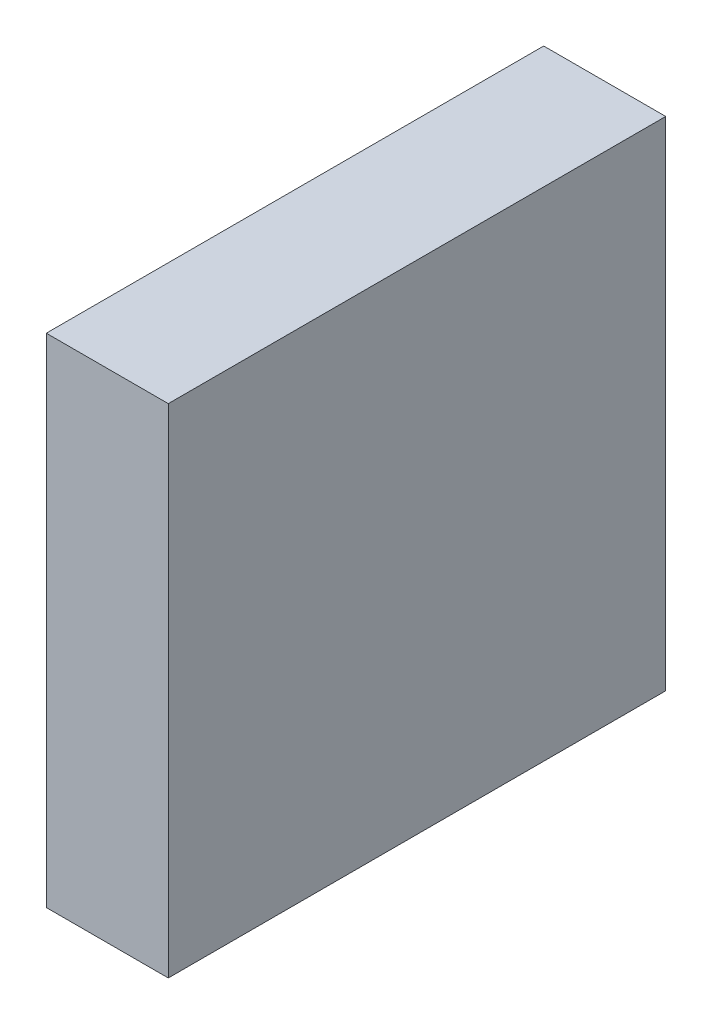
from build123d import *

# Parameters (mm, degrees)
SKETCH1_W           = 53
SKETCH1_H           = 53
BOSS_EXTRUDE1_DEPTH = 13


with BuildPart() as part:
    # Sketch1 → Boss-Extrude1 (new body)
    with BuildSketch(Plane(origin=(0, 0, 0), x_dir=(0, 0, -1), z_dir=(1, 0, 0))):
        with Locations((-26.5, -26.5)):
            Rectangle(SKETCH1_W, SKETCH1_H)
    extrude(amount=BOSS_EXTRUDE1_DEPTH)


solid = part.part
